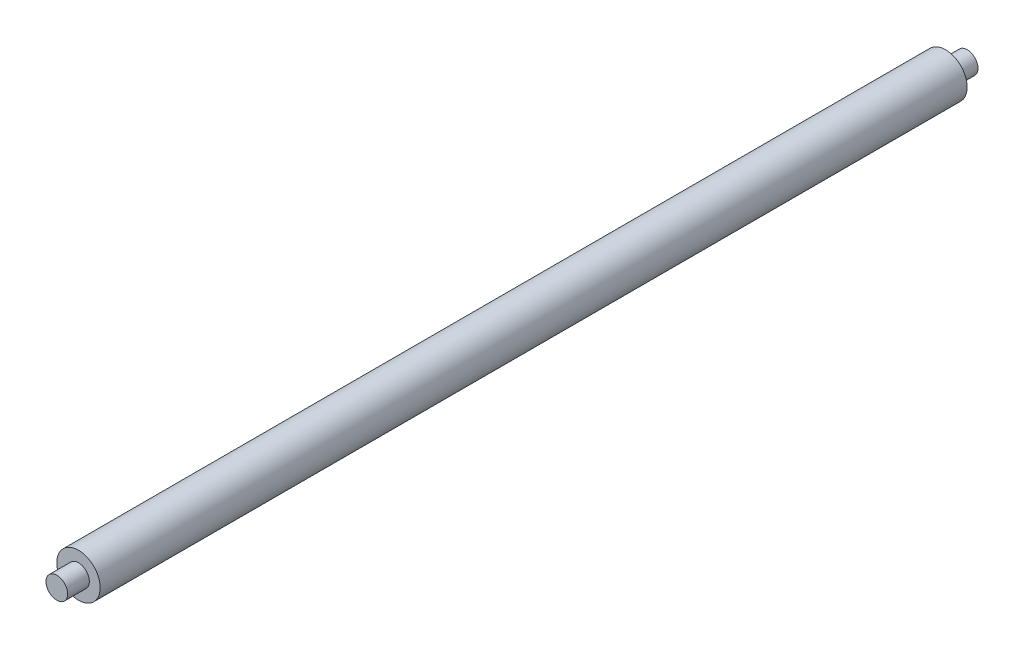
from build123d import *

# Parameters (mm, degrees)
SKETCH1_R           = 5
BOSS_EXTRUDE1_DEPTH = 100
SKETCH2_R           = 2.5
BOSS_EXTRUDE2_DEPTH = 5


with BuildPart() as part:
    # Sketch1 → Boss-Extrude1 (new, symmetric)
    with BuildSketch(Plane.XY):
        Circle(SKETCH1_R)
    extrude(amount=BOSS_EXTRUDE1_DEPTH, both=True)

    # Sketch2 → Boss-Extrude2 (add)
    with BuildSketch(Plane.XY.offset(100)):
        Circle(SKETCH2_R)
    boss_extrude2 = extrude(amount=BOSS_EXTRUDE2_DEPTH)

    # Mirror1: Boss-Extrude2 across plane
    add(boss_extrude2.mirror(Plane.XY))


solid = part.part
